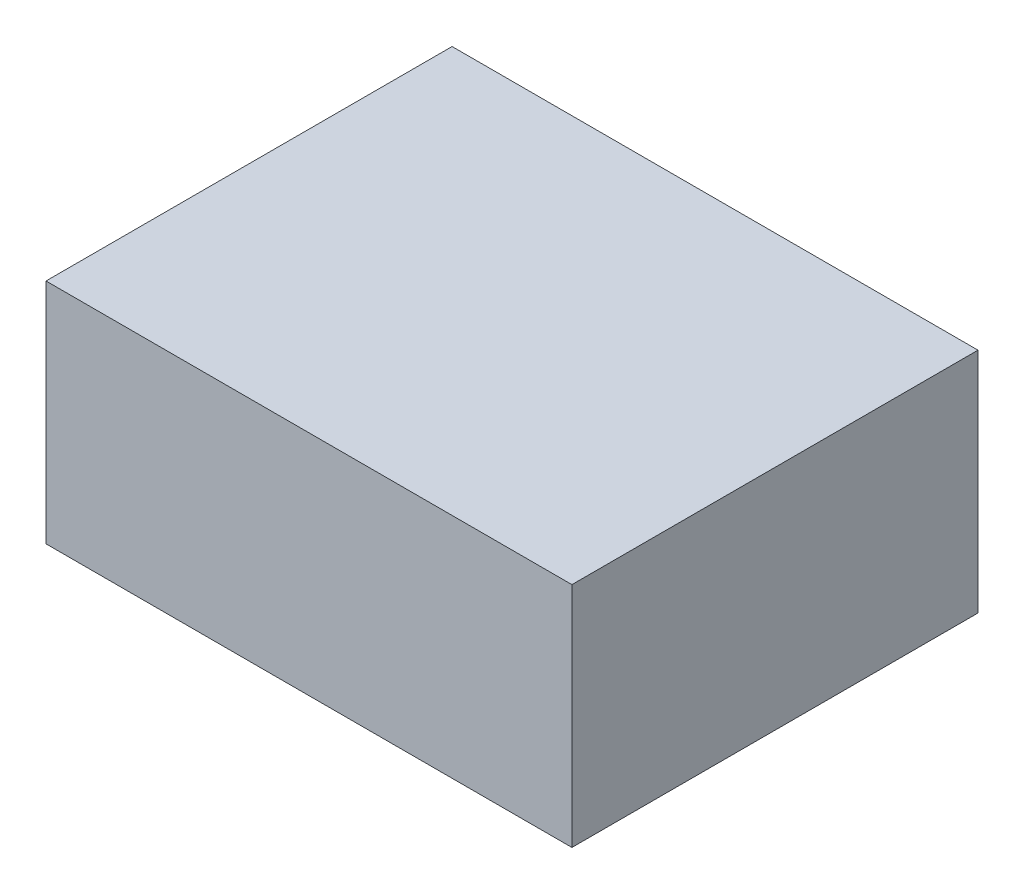
from build123d import *

# Parameters (mm, degrees)
SKETCH1_W           = 115.508176644
SKETCH1_H           = 89.189857914
BOSS_EXTRUDE1_DEPTH = 50


with BuildPart() as part:
    # Sketch1 → Boss-Extrude1 (new body)
    with BuildSketch(Plane(origin=(0, 0, 0), x_dir=(1, 0, 0), z_dir=(0, 1, 0))):
        Rectangle(SKETCH1_W, SKETCH1_H)
    extrude(amount=BOSS_EXTRUDE1_DEPTH)


solid = part.part
